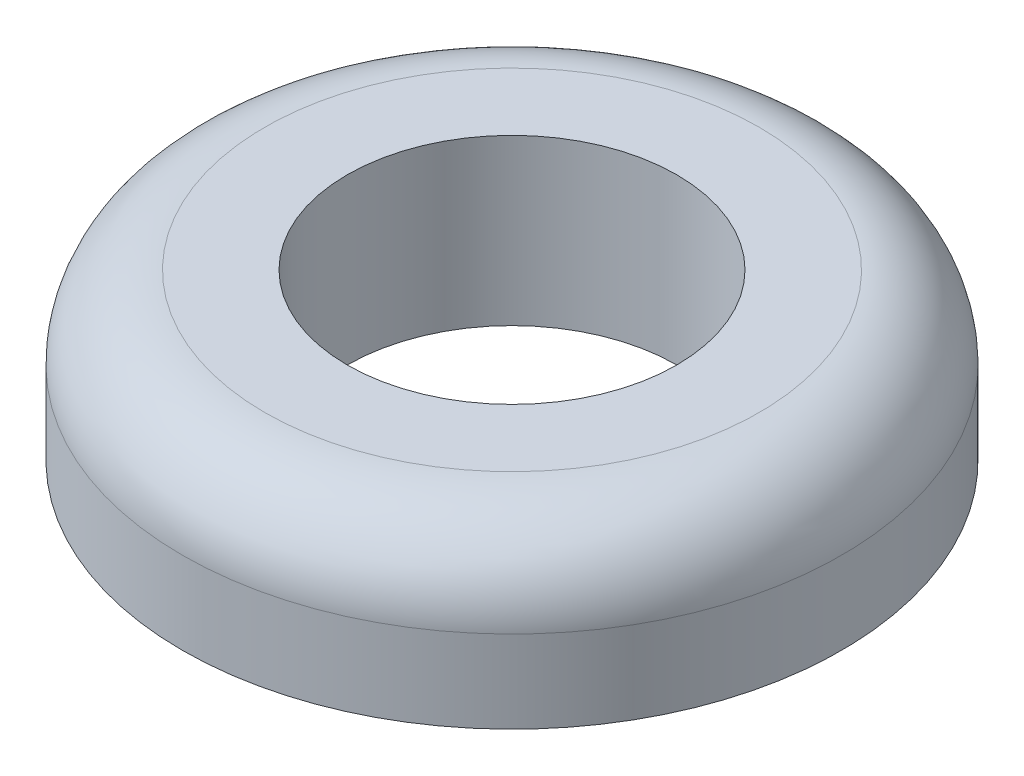
from build123d import *

# Parameters (mm, degrees)
SKETCH1_R           = 6.35
SKETCH1_R_2         = 3.175
BOSS_EXTRUDE1_DEPTH = 3.175
FILLET1_R           = 1.5875


with BuildPart() as part:
    # Sketch1 → Boss-Extrude1 (new body)
    with BuildSketch(Plane(origin=(0, 0, 0), x_dir=(1, 0, 0), z_dir=(0, 1, 0))):
        with Locations(Location((0, 0, 0), (0, 0, 270))):
            Circle(SKETCH1_R)
        with Locations(Location((0, 0, 0), (0, 0, 270))):
            Circle(SKETCH1_R_2, mode=Mode.SUBTRACT)
    extrude(amount=BOSS_EXTRUDE1_DEPTH)

    # Fillet1
    fillet1_edges = [part.edges().sort_by_distance(p)[0] for p in [
        (0, 3.175, -6.35),
    ]]
    fillet(fillet1_edges, radius=FILLET1_R)


solid = part.part
